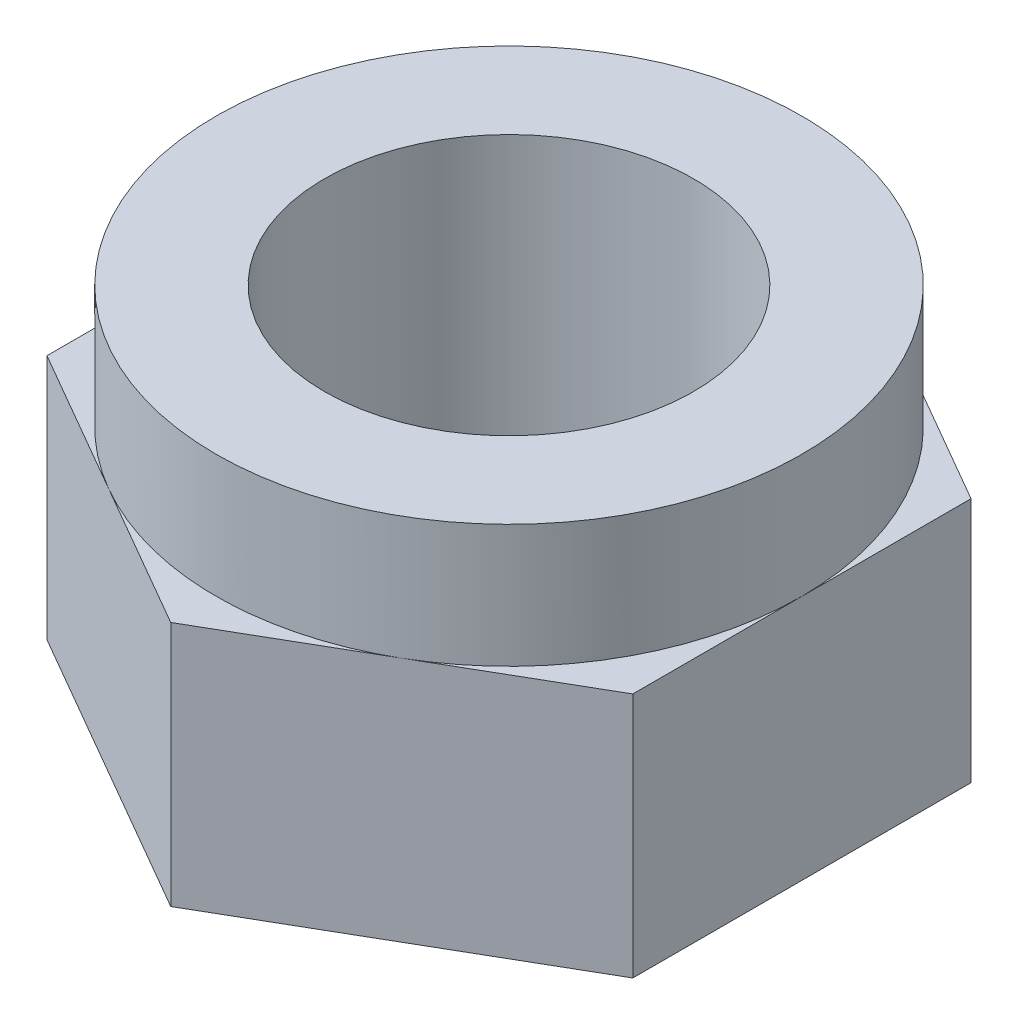
from build123d import *

# Parameters (mm, degrees)
SKETCH1_R           = 3
BOSS_EXTRUDE1_DEPTH = 4
SKETCH2_R           = 4.763139721
SKETCH2_R_2         = 3
BOSS_EXTRUDE2_DEPTH = 2


with BuildPart() as part:
    # Sketch1 → Boss-Extrude1 (new body)
    with BuildSketch(Plane(origin=(0, 0, 0), x_dir=(1, 0, 0), z_dir=(0, 1, 0))):
        Polygon((0, 5.5), (-4.763139721, 2.75), (-4.763139721, -2.75), (0, -5.5), (4.763139721, -2.75), (4.763139721, 2.75), align=None)
        with Locations(Location((0, 0, 0), (0, 0, 270))):
            Circle(SKETCH1_R, mode=Mode.SUBTRACT)
    extrude(amount=BOSS_EXTRUDE1_DEPTH)

    # Sketch2 → Boss-Extrude2 (add)
    with BuildSketch(Plane(origin=(0, 4, 0), x_dir=(1, 0, 0), z_dir=(0, 1, 0))):
        with Locations(Location((0, 0, 0), (0, 0, 60))):
            Circle(SKETCH2_R)
        with Locations(Location((0, 0, 0), (0, 0, 270))):
            Circle(SKETCH2_R_2, mode=Mode.SUBTRACT)
    extrude(amount=BOSS_EXTRUDE2_DEPTH)


solid = part.part
